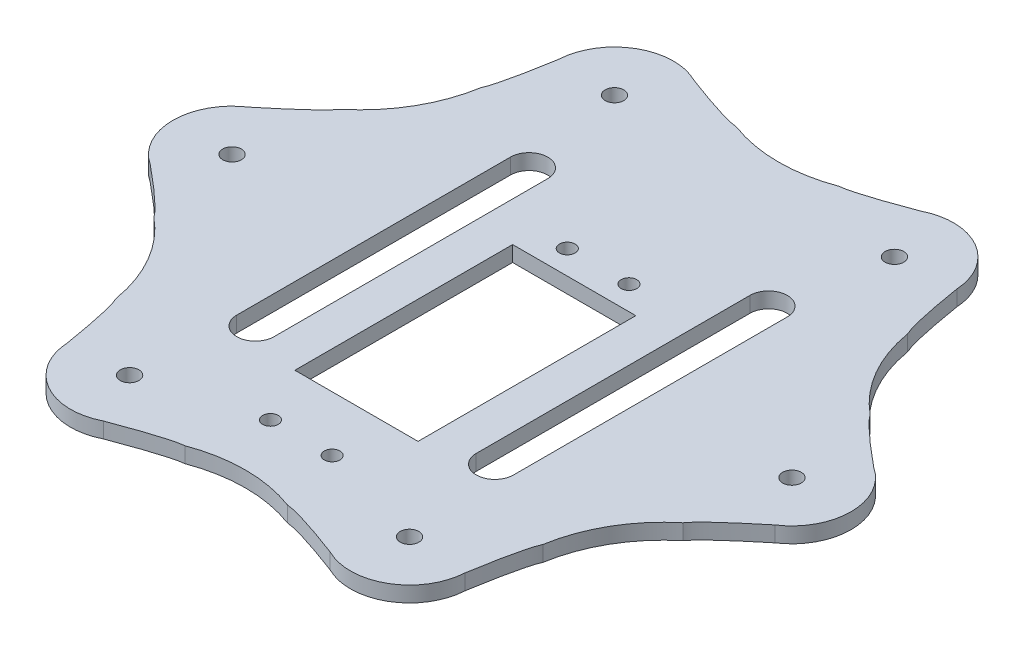
from build123d import *

# Parameters (mm, degrees)
SKETCH1_R           = 45
SKETCH1_R_2         = 1.2573
BOSS_EXTRUDE2_DEPTH = 2.5
BOSS_EXTRUDE4_START = -2.5
BOSS_EXTRUDE4_DEPTH = 2.5
CIRPATTERN1_COUNT   = 6
CUT_EXTRUDE2_DEPTH  = 2.5
SKETCH6_R           = 1.5
CUT_EXTRUDE3_DEPTH  = 5


with BuildPart() as part:
    # Sketch1 → Boss-Extrude2 (new body)
    with BuildSketch(Plane(origin=(0, 0, 0), x_dir=(1, 0, 0), z_dir=(0, 1, 0))):
        with Locations(Location((0, 0, 0), (0, 0, 270))):
            Circle(SKETCH1_R)
        with Locations(Location((-4.955, -33.87, 0), (0, 0, 270))):
            Circle(SKETCH1_R_2, mode=Mode.SUBTRACT)
        with Locations(Location((4.955, -33.87, 0), (0, 0, 90))):
            Circle(SKETCH1_R_2, mode=Mode.SUBTRACT)
        with Locations(Location((-4.955, 13.84, 0), (0, 0, 270))):
            Circle(SKETCH1_R_2, mode=Mode.SUBTRACT)
        with Locations(Location((4.955, 13.84, 0), (0, 0, 90))):
            Circle(SKETCH1_R_2, mode=Mode.SUBTRACT)
        Polygon((-9.9, -25), (-9.9, 0), (-9.9, 10), (9.9, 10), (9.9, 0), (9.9, -25), align=None, mode=Mode.SUBTRACT)
        with BuildLine():
            Line((-22.25, 22), (-22.25, -22))
            ThreePointArc((-22.25, -22), (-19.25, -25), (-16.25, -22))
            Line((-16.25, -22), (-16.25, 22))
            ThreePointArc((-16.25, 22), (-19.25, 25), (-22.25, 22))
        make_face(mode=Mode.SUBTRACT)
        with BuildLine():
            Line((16.25, 22), (16.25, -22))
            ThreePointArc((16.25, -22), (19.25, -25), (22.25, -22))
            Line((22.25, -22), (22.25, 22))
            ThreePointArc((22.25, 22), (19.25, 25), (16.25, 22))
        make_face(mode=Mode.SUBTRACT)
    extrude(amount=BOSS_EXTRUDE2_DEPTH)

    # Sketch2 → Boss-Extrude4 (add)
    with BuildSketch(Plane(origin=(0, 2.5, 0), x_dir=(1, 0, 0), z_dir=(0, 1, 0)).offset(BOSS_EXTRUDE4_START)):
        with BuildLine():
            ThreePointArc((-42.23454554, 15.532004475), (-45, 0), (-42.23454554, -15.532004475))
            add(Edge.make_bspline(
                [(-50.212380227, -7.942360629), (-45.3159648, -11.95963121), (-42.656686571, -14.489512492), (-42.23454554, -15.532004475)],
                knots=[0.089311832, 0.089311832, 0.089311832, 0.089311832, 1, 1, 1, 1], degree=3))
            ThreePointArc((-50.212380227, -7.942360629), (-54.5, 0), (-50.212380227, 7.942360629))
            add(Edge.make_bspline(
                [(-50.212380227, 7.942360629), (-45.3159648, 11.95963121), (-42.656686571, 14.489512492), (-42.23454554, 15.532004475)],
                knots=[0.089311832, 0.089311832, 0.089311832, 0.089311832, 1, 1, 1, 1], degree=3))
        make_face()
    boss_extrude4 = extrude(amount=BOSS_EXTRUDE4_DEPTH)

    # CirPattern1: Boss-Extrude4 ×6 about axis
    cirpattern1_axis = Axis((0, 2.5, 0), (0, 1, 0))
    for i in range(1, CIRPATTERN1_COUNT):
        add(boss_extrude4.rotate(cirpattern1_axis, i * 360 / CIRPATTERN1_COUNT))

    # Sketch5 → Cut-Extrude2 (cut)
    with BuildSketch(Plane(origin=(0, 2.5, 0), x_dir=(1, 0, 0), z_dir=(0, 1, 0))):
        with BuildLine():
            Line((-8.22468756, 44.342191593), (0, 46.65782144))
            Line((0, 46.65782144), (8.22468756, 44.342191593))
            ThreePointArc((8.22468756, 44.342191593), (0, 42.851652617), (-8.22468756, 44.342191593))
        make_face()
        with BuildLine():
            Line((40.406858652, 23.32891072), (42.513808159, 15.048307431))
            ThreePointArc((42.513808159, 15.048307431), (37.11061976, 21.425826308), (34.289120599, 29.293884161))
            Line((34.289120599, 29.293884161), (40.406858652, 23.32891072))
        make_face()
        with BuildLine():
            Line((40.406858652, -23.32891072), (34.289120599, -29.293884161))
            ThreePointArc((34.289120599, -29.293884161), (37.11061976, -21.425826308), (42.513808159, -15.048307431))
            Line((42.513808159, -15.048307431), (40.406858652, -23.32891072))
        make_face()
        with BuildLine():
            Line((0, -46.65782144), (-8.22468756, -44.342191593))
            ThreePointArc((-8.22468756, -44.342191593), (0, -42.851652617), (8.22468756, -44.342191593))
            Line((8.22468756, -44.342191593), (0, -46.65782144))
        make_face()
        with BuildLine():
            Line((-40.406858652, -23.32891072), (-42.513808159, -15.048307431))
            ThreePointArc((-42.513808159, -15.048307431), (-37.11061976, -21.425826308), (-34.289120599, -29.293884161))
            Line((-34.289120599, -29.293884161), (-40.406858652, -23.32891072))
        make_face()
        with BuildLine():
            Line((-40.406858652, 23.32891072), (-34.289120599, 29.293884161))
            ThreePointArc((-34.289120599, 29.293884161), (-37.11061976, 21.425826308), (-42.513808159, 15.048307431))
            Line((-42.513808159, 15.048307431), (-40.406858652, 23.32891072))
        make_face()
    extrude(amount=-CUT_EXTRUDE2_DEPTH, mode=Mode.SUBTRACT)

    # Sketch6 → Cut-Extrude3 (cut, symmetric)
    with BuildSketch(Plane(origin=(0, 2.5, 0), x_dir=(1, 0, 0), z_dir=(0, 1, 0))):
        with Locations(Location((-45, 0, 0), (0, 0, 270))):
            Circle(SKETCH6_R)
        with Locations(Location((-22.5, 38.97114317, 0), (0, 0, 270))):
            Circle(SKETCH6_R)
        with Locations(Location((22.5, 38.97114317, 0), (0, 0, 270))):
            Circle(SKETCH6_R)
        with Locations(Location((45, 0, 0), (0, 0, 270))):
            Circle(SKETCH6_R)
        with Locations(Location((22.5, -38.97114317, 0), (0, 0, 270))):
            Circle(SKETCH6_R)
        with Locations(Location((-22.5, -38.97114317, 0), (0, 0, 270))):
            Circle(SKETCH6_R)
    extrude(amount=CUT_EXTRUDE3_DEPTH, both=True, mode=Mode.SUBTRACT)


solid = part.part
